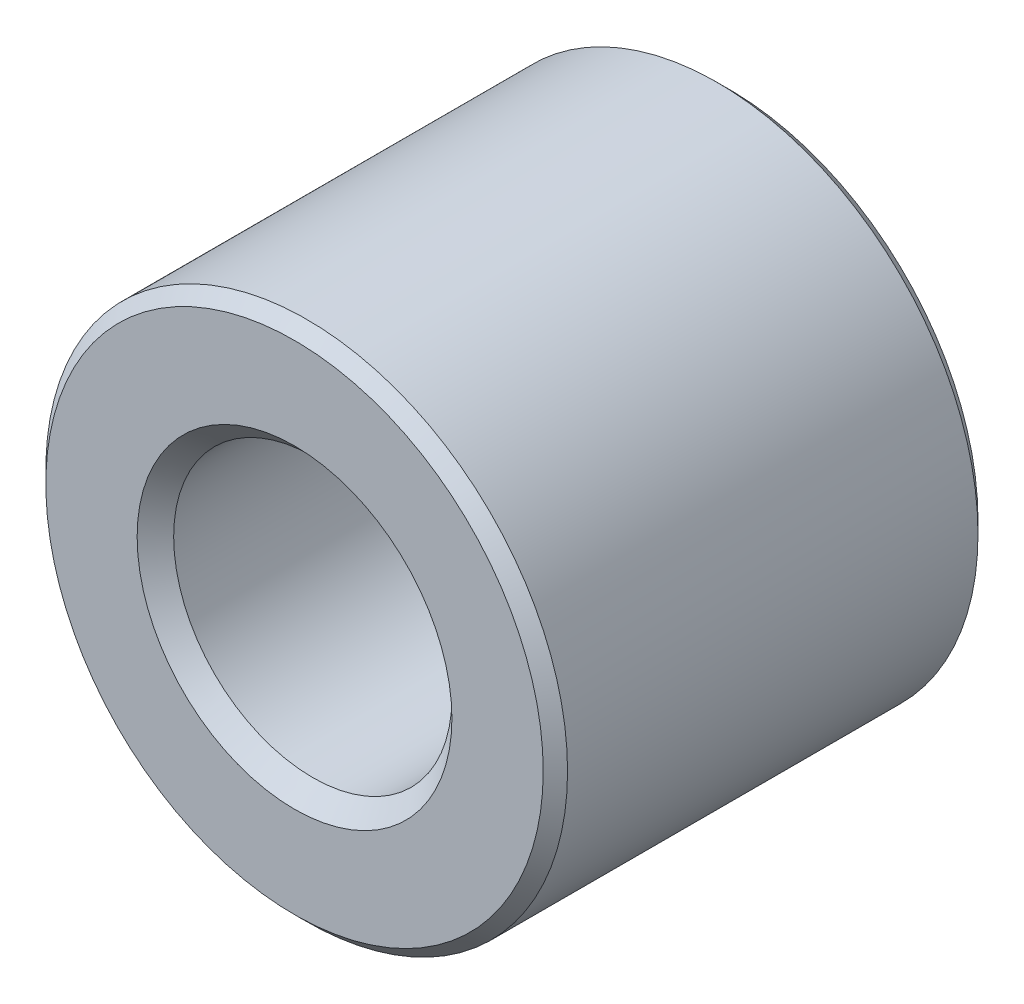
from build123d import *

# Parameters (mm, degrees)
BOSS_EXTRUDE1_DEPTH      = 2.5
BOSS_EXTRUDE1_DEPTH_BACK = 2.5
SKETCH3_R                = 3
SKETCH3_R_2              = 1.6
CHAMFER1_SIZE            = 0.14
CHAMFER2_SIZE            = 0.21


with BuildPart() as part:
    # Sketch3 → Boss-Extrude1 (new, two sides: drawn at the far end of the back side and taken through both)
    with BuildSketch(Plane.XY.offset(-BOSS_EXTRUDE1_DEPTH_BACK)):
        Circle(SKETCH3_R)
        Circle(SKETCH3_R_2, mode=Mode.SUBTRACT)
    extrude(amount=BOSS_EXTRUDE1_DEPTH + BOSS_EXTRUDE1_DEPTH_BACK)

    # Chamfer1
    chamfer1_edges = [part.edges().sort_by_distance(p)[0] for p in [
        (-3, 0, -2.5),
        (-3, 0, 2.5),
    ]]
    chamfer(chamfer1_edges, length=CHAMFER1_SIZE)

    # Chamfer2
    chamfer2_edges = [part.edges().sort_by_distance(p)[0] for p in [
        (-1.6, 0, -2.5),
        (-1.6, 0, 2.5),
    ]]
    chamfer(chamfer2_edges, length=CHAMFER2_SIZE)


solid = part.part
